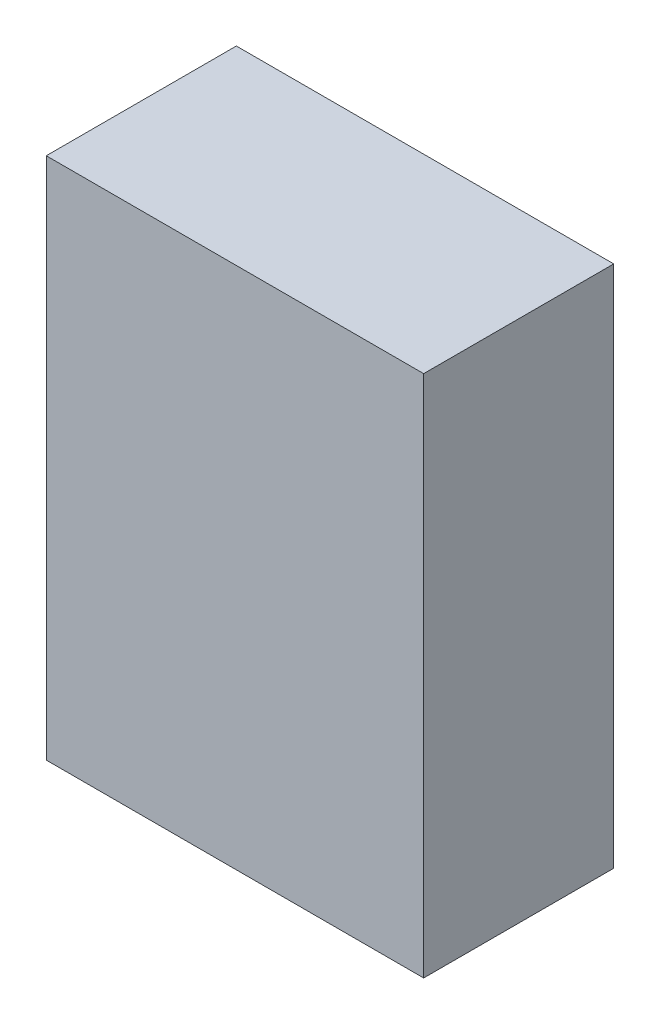
from build123d import *

# Parameters (mm, degrees)
ANCHORSKETCH_W   = 17.125
ANCHORSKETCH_H   = 23.75
ANCHORBOSS_DEPTH = 8.625


with BuildPart() as part:
    # AnchorSketch → AnchorBoss (new body)
    with BuildSketch(Plane.XY):
        with Locations((8.5625, 11.875)):
            Rectangle(ANCHORSKETCH_W, ANCHORSKETCH_H)
    extrude(amount=ANCHORBOSS_DEPTH)


solid = part.part
